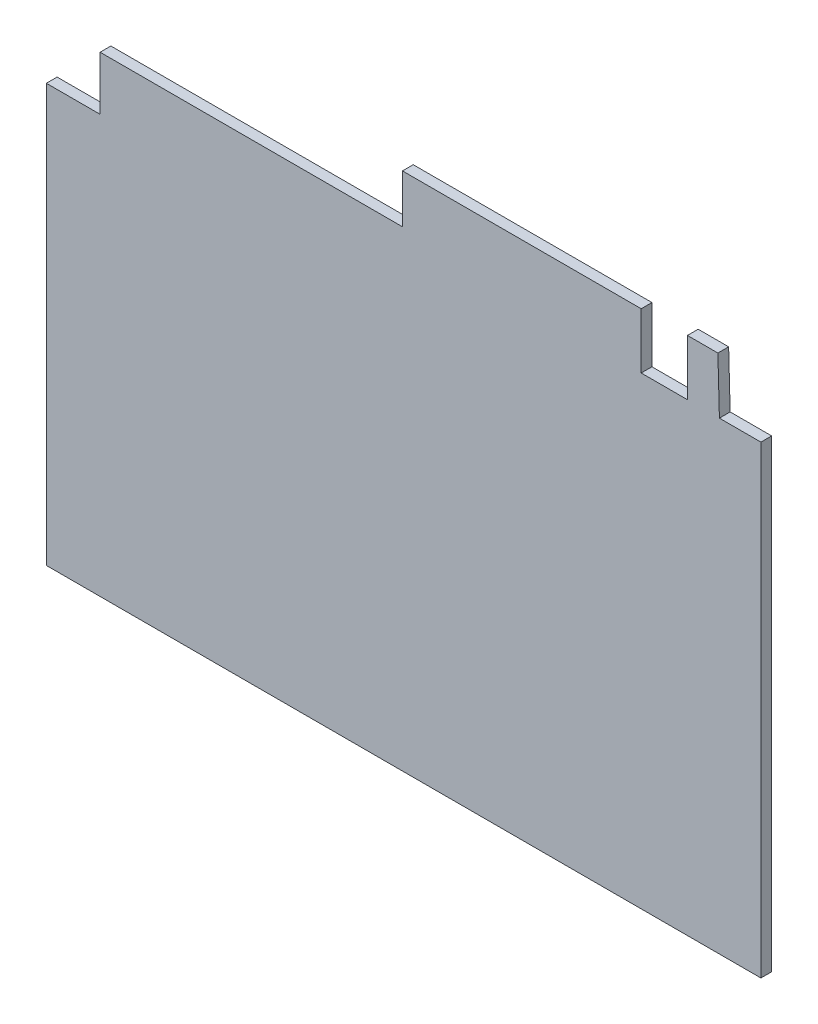
from build123d import *

# Parameters (mm, degrees)
BOSS_EXTRUDE1_DEPTH = 6
SKETCH2_W           = 30
SKETCH2_H           = 30
CUT_EXTRUDE1_DEPTH  = 10
SKETCH3_W           = 398.694966145
SKETCH3_H           = 1
CUT_EXTRUDE2_DEPTH  = 10


with BuildPart() as part:
    # Sketch1 → Boss-Extrude1 (new body)
    with BuildSketch(Plane.XY):
        Polygon((28.571428571, 236.060202245), (28.571428571, 237.05184048), (5.415486436, 237.05184048), (4.571428571, 268.104761905), (-12.428571429, 268.104761905), (-12.428571429, 237.05184048), (-38.216595912, 237.05184048), (-38.216595912, 268.104761905), (-171.428571429, 268.104761905), (-171.428571429, 241.104761905), (-370.123537574, 241.104761905), (-370.123537574, -22.895238095), (28.571428571, -22.895238095), align=None)
    extrude(amount=BOSS_EXTRUDE1_DEPTH)

    # Sketch2 → Cut-Extrude1 (cut)
    with BuildSketch(Plane.XY.offset(6)):
        with Locations((-355.123537574, 226.104761905)):
            Rectangle(SKETCH2_W, SKETCH2_H)
    extrude(amount=-CUT_EXTRUDE1_DEPTH, mode=Mode.SUBTRACT)

    # Sketch3 → Cut-Extrude2 (cut)
    with BuildSketch(Plane.XY.offset(6)):
        with Locations((-170.776054501, -22.395238095)):
            Rectangle(SKETCH3_W, SKETCH3_H)
    extrude(amount=-CUT_EXTRUDE2_DEPTH, mode=Mode.SUBTRACT)


solid = part.part
